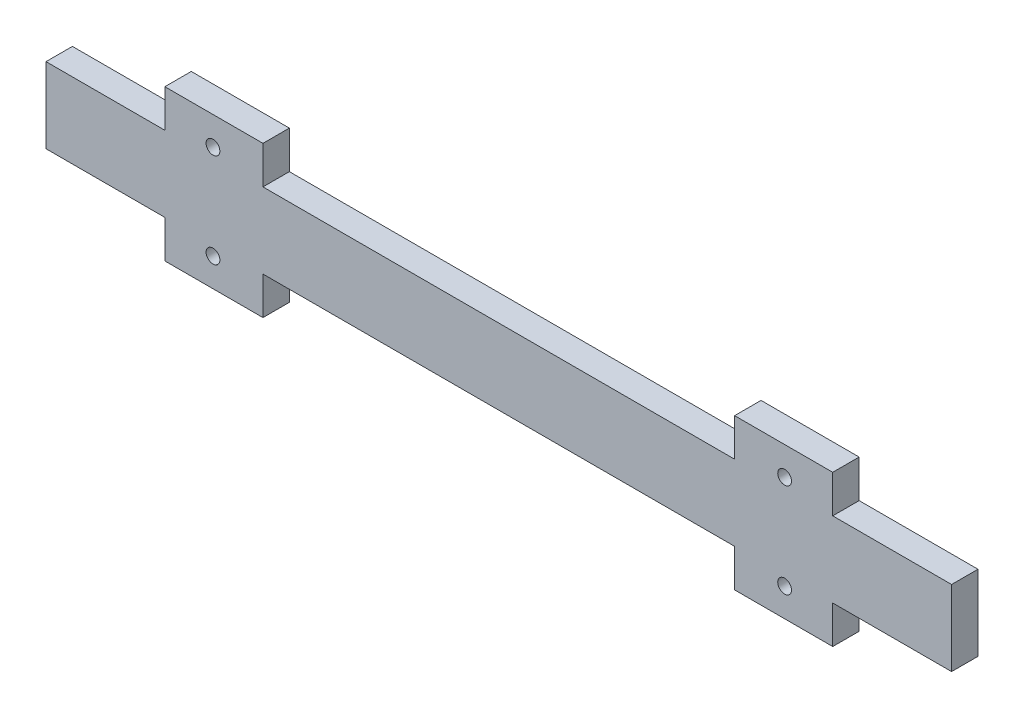
from build123d import *

# Parameters (mm, degrees)
BOSS_EXTRUDE1_DEPTH = 14
SKETCH3_R           = 3.65
CUT_EXTRUDE1_DEPTH  = 14


with BuildPart() as part:
    # Sketch2 → Boss-Extrude1 (new body)
    with BuildSketch(Plane.XY):
        Polygon((-56.968136793, -20), (-56.968136793, 20), (6.031863207, 20), (6.031863207, 40), (58.031863207, 40), (58.031863207, 20), (308.031863207, 20), (308.031863207, 40), (360.031863207, 40), (360.031863207, 20), (423.031863207, 20), (423.031863207, -20), (360.031863207, -20), (360.031863207, -40), (308.031863207, -40), (308.031863207, -20), (58.031863207, -20), (58.031863207, -40), (6.031863207, -40), (6.031863207, -20), align=None)
    extrude(amount=BOSS_EXTRUDE1_DEPTH)

    # Sketch3 → Cut-Extrude1 (cut)
    with BuildSketch(Plane.XY.offset(14)):
        with Locations((31.531863207, 25)):
            Circle(SKETCH3_R)
        with Locations(Location((31.531863207, -25, 0), (0, 0, 180))):
            Circle(SKETCH3_R)
        with Locations((334.531863207, -25)):
            Circle(SKETCH3_R)
        with Locations(Location((334.531863207, 25, 0), (0, 0, 180))):
            Circle(SKETCH3_R)
    extrude(amount=-CUT_EXTRUDE1_DEPTH, mode=Mode.SUBTRACT)


solid = part.part
